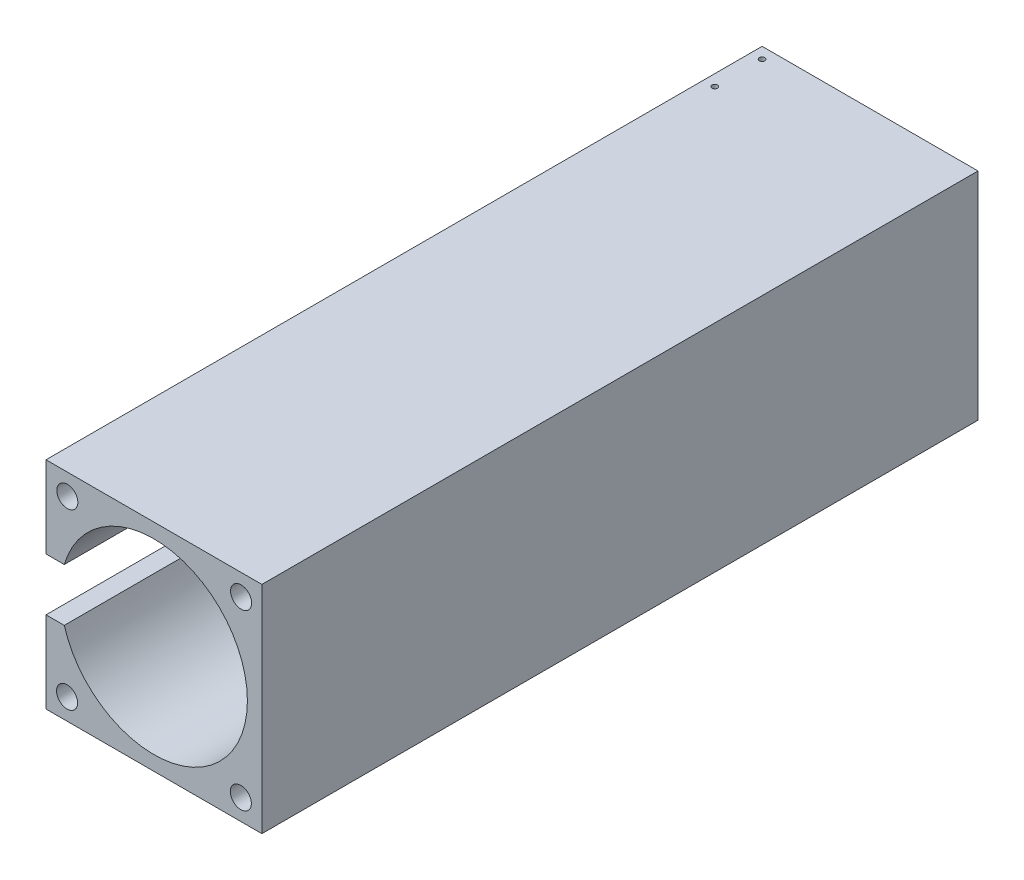
from build123d import *

# Parameters (mm, degrees)
SKETCH_1_W          = 82
SKETCH_1_H          = 82
SKETCH_1_R          = 35.5
EXTRUDE_1_DEPTH     = 245
SKETCH_2_W          = 82
SKETCH_2_H          = 82
EXTRUDE_2_DEPTH     = 27
SKETCH_3_W          = 8
SKETCH_3_H          = 20
CUT_EXTRUDE_1_DEPTH = 245
SKETCH_4_R          = 4
CUT_EXTRUDE_2_DEPTH = 20
FILLET_2_R          = 3
FILLET_3_R          = 3
FILLET_4_R          = 3
FILLET_5_R          = 3
SKETCH_5_R          = 1.05
CUT_EXTRUDE_3_DEPTH = 10
EXTRUDE_START       = 0.2
SKETCH_6_R          = 1.05
EXTRUDE_3_DEPTH     = 0.2


with BuildPart() as part:
    # 草圖1 → 填料-伸長1 (new body)
    with BuildSketch(Plane.XY):
        Rectangle(SKETCH_1_W, SKETCH_1_H)
        Circle(SKETCH_1_R, mode=Mode.SUBTRACT)
    extrude(amount=EXTRUDE_1_DEPTH)

    # 草圖2 → 填料-伸長2 (add)
    with BuildSketch(Plane(origin=(0, 0, 0), x_dir=(-1, 0, 0), z_dir=(0, 0, -1))):
        Rectangle(SKETCH_2_W, SKETCH_2_H)
    extrude(amount=EXTRUDE_2_DEPTH)

    # 草圖3 → 除料-伸長1 (cut)
    with BuildSketch(Plane.XY.offset(245)):
        with Locations((-37, 0)):
            Rectangle(SKETCH_3_W, SKETCH_3_H)
    extrude(amount=-CUT_EXTRUDE_1_DEPTH, mode=Mode.SUBTRACT)

    # 草圖4 → 除料-伸長2 (cut)
    with BuildSketch(Plane.XY.offset(245)):
        with Locations((-32.9, 33)):
            Circle(SKETCH_4_R)
        with Locations((33.1, 32.9)):
            Circle(SKETCH_4_R)
        with Locations((33, -33.1)):
            Circle(SKETCH_4_R)
        with Locations((-33, -33)):
            Circle(SKETCH_4_R)
    extrude(amount=-CUT_EXTRUDE_2_DEPTH, mode=Mode.SUBTRACT)

    # 圓角2
    fillet_2_edges = [part.edges().sort_by_distance(p)[0] for p in [
        (-36.9, 33, 225),
    ]]
    fillet(fillet_2_edges, radius=FILLET_2_R)

    # 圓角3
    fillet_3_edges = [part.edges().sort_by_distance(p)[0] for p in [
        (29.1, 32.9, 225),
    ]]
    fillet(fillet_3_edges, radius=FILLET_3_R)

    # 圓角4
    fillet_4_edges = [part.edges().sort_by_distance(p)[0] for p in [
        (-37, -33, 225),
    ]]
    fillet(fillet_4_edges, radius=FILLET_4_R)

    # 圓角5
    fillet_5_edges = [part.edges().sort_by_distance(p)[0] for p in [
        (29, -33.1, 225),
    ]]
    fillet(fillet_5_edges, radius=FILLET_5_R)

    # 草圖5 → 除料-伸長3 (cut)
    with BuildSketch(Plane(origin=(0, 41, 0), x_dir=(1, 0, 0), z_dir=(0, 1, 0))):
        with Locations(Location((-36.75, 22.75, 0), (0, 0, 270))):
            Circle(SKETCH_5_R)
        with Locations(Location((-36.75, 4.75, 0), (0, 0, 270))):
            Circle(SKETCH_5_R)
    extrude(amount=-CUT_EXTRUDE_3_DEPTH, mode=Mode.SUBTRACT)

    # 草圖6 → 填料-伸長3 (add)
    with BuildSketch(Plane(origin=(0, 35, 0), x_dir=(1, 0, 0), z_dir=(0, 1, 0)).offset(EXTRUDE_START)):
        with Locations(Location((-36.75, 22.75, 0), (0, 0, 270))):
            Circle(SKETCH_6_R)
        with Locations(Location((-36.75, 4.75, 0), (0, 0, 270))):
            Circle(SKETCH_6_R)
    extrude(amount=-EXTRUDE_3_DEPTH)


solid = part.part
